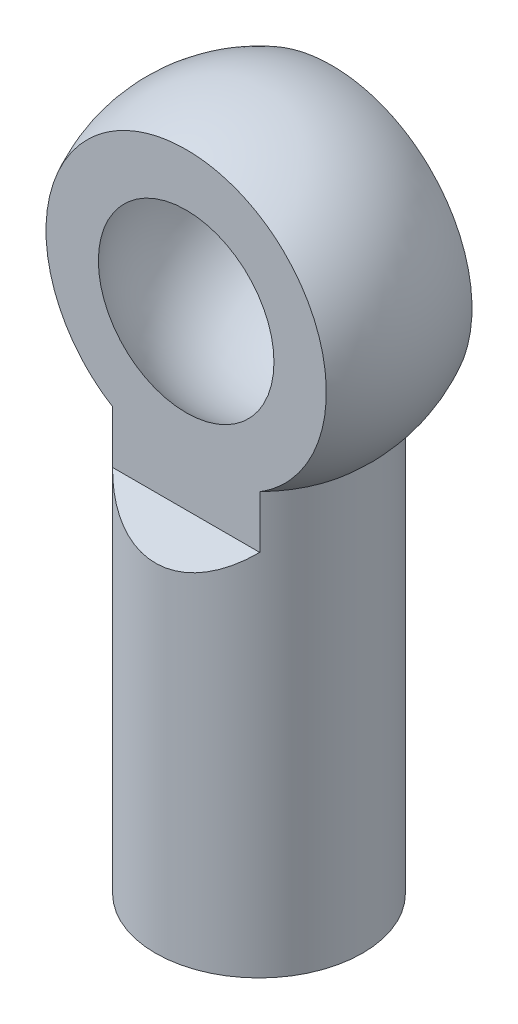
from build123d import *

# Parameters (mm, degrees)
SKETCH1_R               = 2.95
BOSS_EXTRUDE1_DEPTH     = 12
SKETCH5_R               = 1.5
CUT_EXTRUDE3_DEPTH      = 11
CUT_EXTRUDE4_DEPTH      = 21.891070385
CUT_EXTRUDE4_DEPTH_BACK = 21.891070385
SKETCH12_R              = 3.400000058
SKETCH12_R_2            = 2.501374622
BOSS_EXTRUDE5_DEPTH     = 0.02


with BuildPart() as part:
    # Sketch1 → Boss-Extrude1 (new body)
    with BuildSketch(Plane(origin=(0, 0, 0), x_dir=(1, 0, 0), z_dir=(0, 1, 0))):
        with Locations(Location((0, 0, 0), (0, 0, 270))):
            Circle(SKETCH1_R)
    extrude(amount=BOSS_EXTRUDE1_DEPTH)

    # Sketch5 → Cut-Extrude3 (cut)
    with BuildSketch(Plane.XZ):
        with Locations(Location((0, 0, 0), (0, 0, 270))):
            Circle(SKETCH5_R)
    extrude(amount=-CUT_EXTRUDE3_DEPTH, mode=Mode.SUBTRACT)

    # Sketch2 → Revolve3 (revolve)
    with BuildSketch(Plane(origin=(0, 0, 0), x_dir=(0, 0, -1), z_dir=(1, 0, 0))):
        with BuildLine():
            Line((0, 19.898161268), (0, 10.898161268))
            ThreePointArc((0, 10.898161268), (4.5, 15.398161268), (0, 19.898161268))
        make_face()
    revolve(axis=Axis((0, 12, 0), (0, -1, 0)))

    # Sketch8 → Cut-Extrude4 (cut, two sides: drawn at the far end of the back side and taken through both)
    with BuildSketch(Plane(origin=(0, 0, 0), x_dir=(0, 0, -1), z_dir=(1, 0, 0)).offset(-CUT_EXTRUDE4_DEPTH_BACK)):
        Polygon((-2.075, 20.390789919), (-2.075, 10.5), (-5.08, 7.495), (-5.08, 20.390789919), align=None)
        Polygon((5.08, 20.390789919), (2.075, 20.390789919), (2.075, 10.5), (5.08, 7.495), align=None)
    extrude(amount=CUT_EXTRUDE4_DEPTH + CUT_EXTRUDE4_DEPTH_BACK, mode=Mode.SUBTRACT)

    # Sketch11 → Cut-Revolve2 (revolve, cut)
    with BuildSketch(Plane(origin=(0, 0, 0), x_dir=(0, 0, -1), z_dir=(1, 0, 0))):
        with BuildLine():
            Line((-3.25, 15.398161268), (3.25, 15.398161268))
            ThreePointArc((3.25, 15.398161268), (0, 18.648161268), (-3.25, 15.398161268))
        make_face()
    revolve(axis=Axis((0, 15.398161268, 2.075), (0, 0, -1)), mode=Mode.SUBTRACT)

    # Sketch12 → Boss-Extrude5 (add)
    with BuildSketch(Plane(origin=(0, 0, -2.075), x_dir=(-1, 0, 0), z_dir=(0, 0, -1))):
        with Locations(Location((0, 15.398161268, 0), (0, 0, 270))):
            Circle(SKETCH12_R)
        with Locations(Location((0, 15.398161268, 0), (0, 0, 90))):
            Circle(SKETCH12_R_2, mode=Mode.SUBTRACT)
    extrude(amount=BOSS_EXTRUDE5_DEPTH)


solid = part.part
